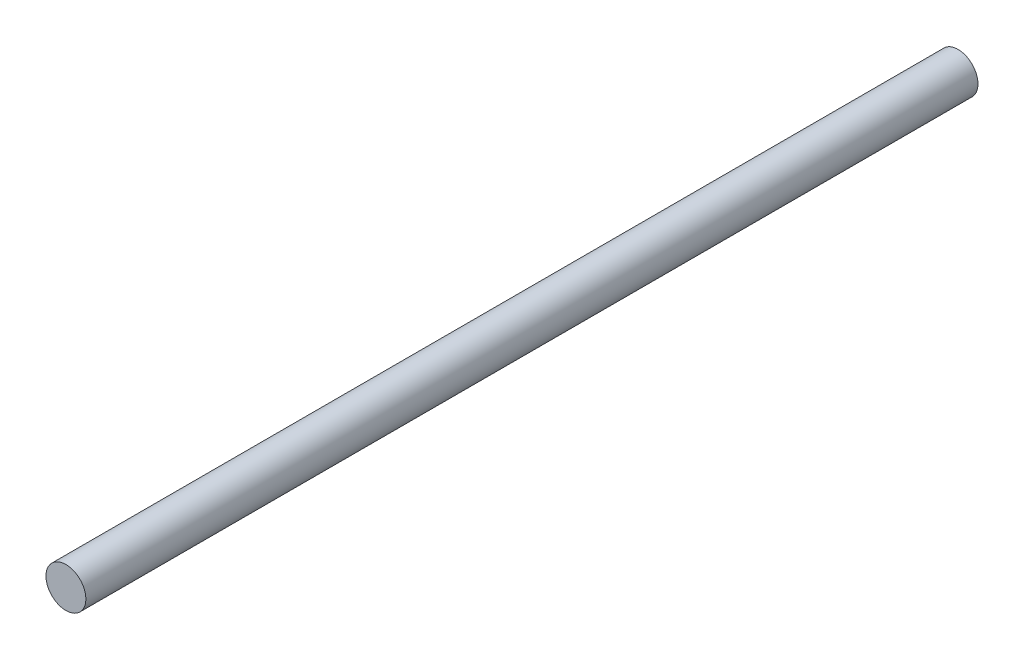
from build123d import *

# Parameters (mm, degrees)
SKETCH1_R           = 3.9751
BOSS_EXTRUDE1_DEPTH = 177.8


with BuildPart() as part:
    # Sketch1 → Boss-Extrude1 (new body)
    with BuildSketch(Plane.XY):
        Circle(SKETCH1_R)
    extrude(amount=-BOSS_EXTRUDE1_DEPTH)


solid = part.part
